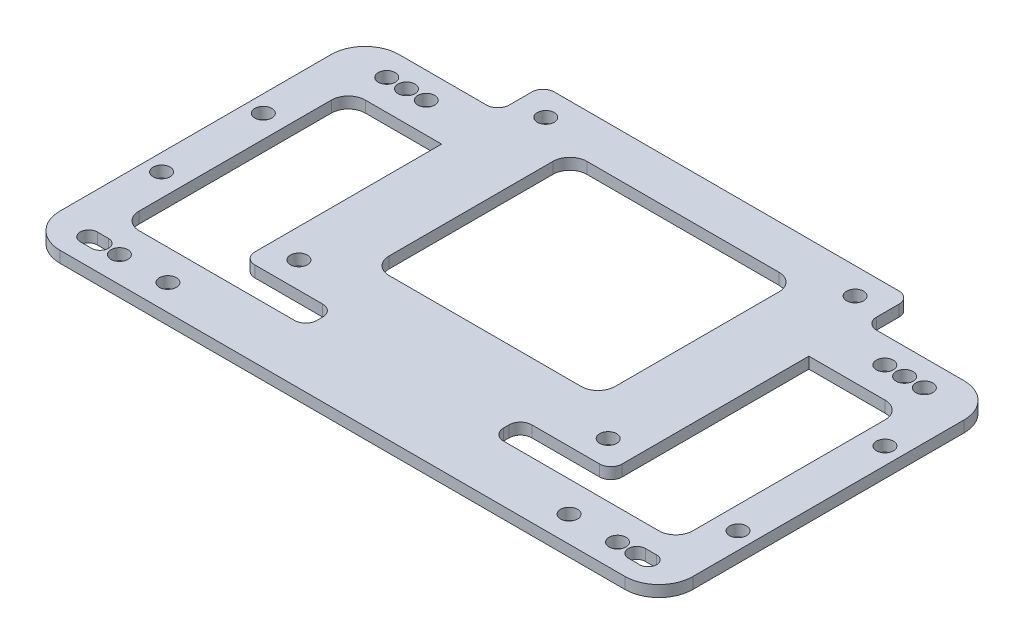
from build123d import *

# Parameters (mm, degrees)
SKETCH_1_R      = 1.5
EXTRUDE_1_DEPTH = 2


with BuildPart() as part:
    # 草图1 → 凸台-拉伸1 (new body)
    with BuildSketch(Plane(origin=(0, 0, 0), x_dir=(1, 0, 0), z_dir=(0, 1, 0))):
        with BuildLine():
            Line((-49.990380792, -29.946956811), (49.990380792, -29.946956811))
            ThreePointArc((49.990380792, -29.946956811), (54.239823286, -28.186780098), (56, -23.937337603))
            Line((56, -23.937337603), (56, 24.043423981))
            ThreePointArc((56, 24.043423981), (54.239823286, 28.292866475), (49.990380792, 30.053043189))
            Line((49.990380792, 30.053043189), (34.49744459, 30.053043189))
            ThreePointArc((34.49744459, 30.053043189), (33.085037975, 30.638081164), (32.5, 32.050487778))
            Line((32.5, 32.050487778), (32.5, 36.050487778))
            ThreePointArc((32.5, 36.050487778), (31.914213562, 37.464701341), (30.5, 38.050487778))
            Line((30.5, 38.050487778), (-30.5, 38.050487778))
            ThreePointArc((-30.5, 38.050487778), (-31.914213562, 37.464701341), (-32.5, 36.050487778))
            Line((-32.5, 36.050487778), (-32.5, 32.050487778))
            ThreePointArc((-32.5, 32.050487778), (-33.085037975, 30.638081164), (-34.49744459, 30.053043189))
            Line((-34.49744459, 30.053043189), (-49.990380792, 30.053043189))
            ThreePointArc((-49.990380792, 30.053043189), (-54.239823286, 28.292866475), (-56, 24.043423981))
            Line((-56, 24.043423981), (-56, -23.937337603))
            ThreePointArc((-56, -23.937337603), (-54.239823286, -28.186780098), (-49.990380792, -29.946956811))
        make_face()
        with Locations(Location((27.37, 33.395487778, 0), (0, 0, 270))):
            Circle(SKETCH_1_R, mode=Mode.SUBTRACT)
        with Locations(Location((27.37, -10.294512222, 0), (0, 0, 270))):
            Circle(SKETCH_1_R, mode=Mode.SUBTRACT)
        with Locations(Location((53, 13.050487778, 0), (0, 0, 270))):
            Circle(SKETCH_1_R, mode=Mode.SUBTRACT)
        with Locations(Location((53, -12.949512222, 0), (0, 0, 270))):
            Circle(SKETCH_1_R, mode=Mode.SUBTRACT)
        with Locations(Location((35.500000351, -25.346956811, 0), (0, 0, 270))):
            Circle(SKETCH_1_R, mode=Mode.SUBTRACT)
        with Locations(Location((-27.37, 33.395487778, 0), (0, 0, 270))):
            Circle(SKETCH_1_R, mode=Mode.SUBTRACT)
        with Locations(Location((-53, 9.050487778, 0), (0, 0, 270))):
            Circle(SKETCH_1_R, mode=Mode.SUBTRACT)
        with Locations(Location((-53, -8.949512222, 0), (0, 0, 270))):
            Circle(SKETCH_1_R, mode=Mode.SUBTRACT)
        with Locations(Location((-35.499999649, -25.346956811, 0), (0, 0, 270))):
            Circle(SKETCH_1_R, mode=Mode.SUBTRACT)
        with Locations(Location((-27.37, -10.294512222, 0), (0, 0, 270))):
            Circle(SKETCH_1_R, mode=Mode.SUBTRACT)
        with Locations(Location((-44.07, -25.346956811, 0), (0, 0, 270))):
            Circle(SKETCH_1_R, mode=Mode.SUBTRACT)
        with Locations(Location((44.07, -25.346956811, 0), (0, 0, 270))):
            Circle(SKETCH_1_R, mode=Mode.SUBTRACT)
        with Locations(Location((-44.07, 25.453043189, 0), (0, 0, 270))):
            Circle(SKETCH_1_R, mode=Mode.SUBTRACT)
        with Locations(Location((-47.57, 25.453043189, 0), (0, 0, 270))):
            Circle(SKETCH_1_R, mode=Mode.SUBTRACT)
        with Locations(Location((-40.57, 25.453043189, 0), (0, 0, 270))):
            Circle(SKETCH_1_R, mode=Mode.SUBTRACT)
        with Locations(Location((44.07, 25.453043189, 0), (0, 0, 270))):
            Circle(SKETCH_1_R, mode=Mode.SUBTRACT)
        with Locations(Location((47.57, 25.453043189, 0), (0, 0, 270))):
            Circle(SKETCH_1_R, mode=Mode.SUBTRACT)
        with Locations(Location((40.57, 25.453043189, 0), (0, 0, 270))):
            Circle(SKETCH_1_R, mode=Mode.SUBTRACT)
        with BuildLine():
            Line((-46, -19.949512222), (-18.5, -19.949512222))
            ThreePointArc((-18.5, -19.949512222), (-17.085786438, -19.363725784), (-16.5, -17.949512222))
            Line((-16.5, -17.949512222), (-16.5, -16.949512222))
            ThreePointArc((-16.5, -16.949512222), (-17.085786438, -15.535298659), (-18.5, -14.949512222))
            Line((-18.5, -14.949512222), (-30.5, -14.949512222))
            ThreePointArc((-30.5, -14.949512222), (-31.914213562, -14.363725784), (-32.5, -12.949512222))
            Line((-32.5, -12.949512222), (-32.5, 20.08975605))
            Line((-32.5, 20.08975605), (-46, 20.08975605))
            ThreePointArc((-46, 20.08975605), (-48.121320344, 19.211076394), (-49, 17.08975605))
            Line((-49, 17.08975605), (-49, -16.949512222))
            ThreePointArc((-49, -16.949512222), (-48.121320344, -19.070832565), (-46, -19.949512222))
        make_face(mode=Mode.SUBTRACT)
        with BuildLine():
            Line((49, -16.949512222), (49, 17.08975605))
            ThreePointArc((49, 17.08975605), (48.121320344, 19.211076394), (46, 20.08975605))
            Line((46, 20.08975605), (32.5, 20.08975605))
            Line((32.5, 20.08975605), (32.5, -12.949512222))
            ThreePointArc((32.5, -12.949512222), (31.914213562, -14.363725784), (30.5, -14.949512222))
            Line((30.5, -14.949512222), (18.5, -14.949512222))
            ThreePointArc((18.5, -14.949512222), (17.085786438, -15.535298659), (16.5, -16.949512222))
            Line((16.5, -16.949512222), (16.5, -17.949512222))
            ThreePointArc((16.5, -17.949512222), (17.085786438, -19.363725784), (18.5, -19.949512222))
            Line((18.5, -19.949512222), (46, -19.949512222))
            ThreePointArc((46, -19.949512222), (48.121320344, -19.070832565), (49, -16.949512222))
        make_face(mode=Mode.SUBTRACT)
        with BuildLine():
            Line((-17, 30.300487778), (17, 30.300487778))
            ThreePointArc((17, 30.300487778), (19.121320344, 29.421808122), (20, 27.300487778))
            Line((20, 27.300487778), (20, -1.699512222))
            ThreePointArc((20, -1.699512222), (19.121320344, -3.820832565), (17, -4.699512222))
            Line((17, -4.699512222), (-17, -4.699512222))
            ThreePointArc((-17, -4.699512222), (-19.121320344, -3.820832565), (-20, -1.699512222))
            Line((-20, -1.699512222), (-20, 27.300487778))
            ThreePointArc((-20, 27.300487778), (-19.121320344, 29.421808122), (-17, 30.300487778))
        make_face(mode=Mode.SUBTRACT)
        with BuildLine():
            Line((47.5, -23.846956811), (49.5, -23.846956811))
            ThreePointArc((49.5, -23.846956811), (51, -25.346956811), (49.5, -26.846956811))
            Line((49.5, -26.846956811), (47.5, -26.846956811))
            ThreePointArc((47.5, -26.846956811), (46, -25.346956811), (47.5, -23.846956811))
        make_face(mode=Mode.SUBTRACT)
        with BuildLine():
            Line((-47.5, -23.839893014), (-49.5, -23.839893014))
            ThreePointArc((-49.5, -23.839893014), (-51.007063798, -25.346956811), (-49.5, -26.854020609))
            Line((-49.5, -26.854020609), (-47.5, -26.854020609))
            ThreePointArc((-47.5, -26.854020609), (-45.992936202, -25.346956811), (-47.5, -23.839893014))
        make_face(mode=Mode.SUBTRACT)
    extrude(amount=EXTRUDE_1_DEPTH)


solid = part.part
